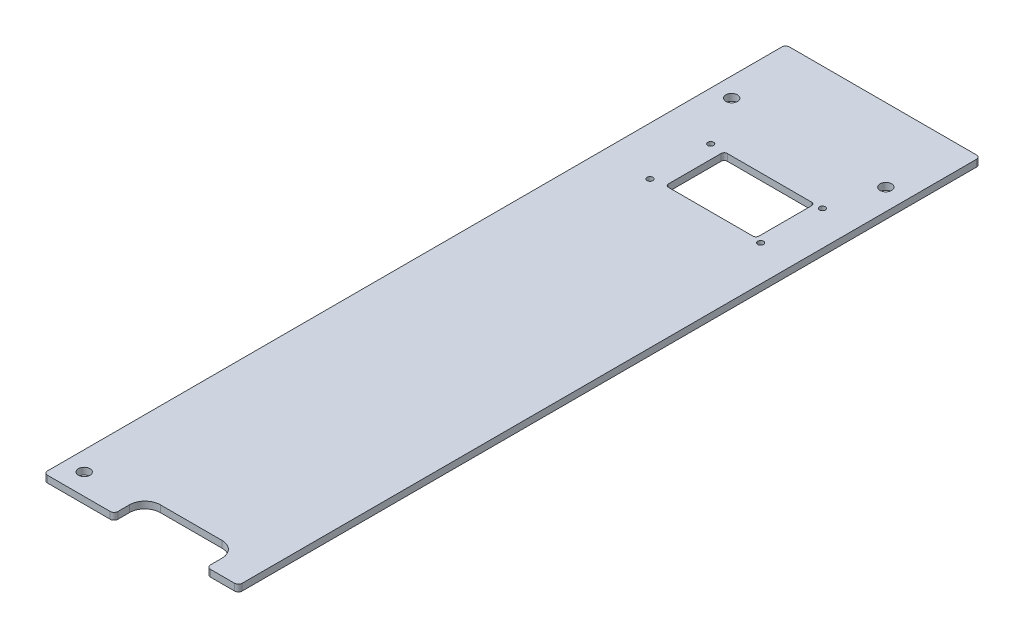
from build123d import *

# Parameters (mm, degrees)
SKETCH1_W           = 160.3375
SKETCH1_H           = 611.1875
BOSS_EXTRUDE1_DEPTH = 5.588
FILLET1_R           = 3.175
SKETCH2_R           = 4.7625
CUT_EXTRUDE1_DEPTH  = 6.35
SKETCH3_W           = 76.2
SKETCH3_H           = 25.4
CUT_EXTRUDE2_DEPTH  = 6.35
FILLET2_R           = 3.175
FILLET3_R           = 12.7
SKETCH4_R           = 2.38125
CUT_EXTRUDE3_DEPTH  = 25.4


with BuildPart() as part:
    # Sketch1 → Boss-Extrude1 (new body)
    with BuildSketch(Plane(origin=(0, 0, 0), x_dir=(1, 0, 0), z_dir=(0, 1, 0))):
        Rectangle(SKETCH1_W, SKETCH1_H)
    extrude(amount=BOSS_EXTRUDE1_DEPTH)

    # Fillet1
    fillet1_edges = [part.edges().sort_by_distance(p)[0] for p in [
        (80.16875, 2.794, 305.59375),
        (-80.16875, 2.794, 305.59375),
        (-80.16875, 2.794, -305.59375),
        (80.16875, 2.794, -305.59375),
    ]]
    fillet(fillet1_edges, radius=FILLET1_R)

    # Sketch2 → Cut-Extrude1 (cut)
    with BuildSketch(Plane(origin=(0, 5.588, 0), x_dir=(1, 0, 0), z_dir=(0, 1, 0))):
        with Locations(Location((62.70625, 245.26875, 0), (0, 0, 270))):
            Circle(SKETCH2_R)
        with Locations(Location((-64.29375, 245.26875, 0), (0, 0, 270))):
            Circle(SKETCH2_R)
        with Locations(Location((-64.29375, -288.13125, 0), (0, 0, 270))):
            Circle(SKETCH2_R)
    extrude(amount=-CUT_EXTRUDE1_DEPTH, mode=Mode.SUBTRACT)

    # Sketch3 → Cut-Extrude2 (cut)
    with BuildSketch(Plane(origin=(0, 5.588, 0), x_dir=(1, 0, 0), z_dir=(0, 1, 0))):
        with Locations((15.875, -292.89375)):
            Rectangle(SKETCH3_W, SKETCH3_H)
    extrude(amount=-CUT_EXTRUDE2_DEPTH, mode=Mode.SUBTRACT)

    # Fillet2
    fillet2_edges = [part.edges().sort_by_distance(p)[0] for p in [
        (-22.225, 2.794, 305.59375),
        (53.975, 2.794, 305.59375),
    ]]
    fillet(fillet2_edges, radius=FILLET2_R)

    # Fillet3
    fillet3_edges = [part.edges().sort_by_distance(p)[0] for p in [
        (-22.225, 2.794, 280.19375),
        (53.975, 2.794, 280.19375),
    ]]
    fillet(fillet3_edges, radius=FILLET3_R)

    # Sketch4 → Cut-Extrude3 (cut)
    with BuildSketch(Plane(origin=(0, 5.588, 0), x_dir=(1, 0, 0), z_dir=(0, 1, 0))):
        with Locations(Location((-40.29075, 203.99375, 0), (0, 0, 270))):
            Circle(SKETCH4_R)
        with Locations(Location((-40.29075, 153.95575, 0), (0, 0, 270))):
            Circle(SKETCH4_R)
        with Locations(Location((51.745051389, 203.99375, 0), (0, 0, 270))):
            Circle(SKETCH4_R)
        with Locations(Location((50.89525, 153.95575, 0), (0, 0, 270))):
            Circle(SKETCH4_R)
        with BuildLine():
            Line((-26.63825, 203.99375), (42.839342829, 203.99375))
            ThreePointArc((42.839342829, 203.99375), (44.635394053, 203.249801224), (45.379342829, 201.45375))
            Line((45.379342829, 201.45375), (45.379342829, 158.115))
            ThreePointArc((45.379342829, 158.115), (44.635394053, 156.318948776), (42.839342829, 155.575))
            Line((42.839342829, 155.575), (-26.63825, 155.575))
            ThreePointArc((-26.63825, 155.575), (-28.434301224, 156.318948776), (-29.17825, 158.115))
            Line((-29.17825, 158.115), (-29.17825, 201.45375))
            ThreePointArc((-29.17825, 201.45375), (-28.434301224, 203.249801224), (-26.63825, 203.99375))
        make_face()
    extrude(amount=-CUT_EXTRUDE3_DEPTH, mode=Mode.SUBTRACT)


solid = part.part
